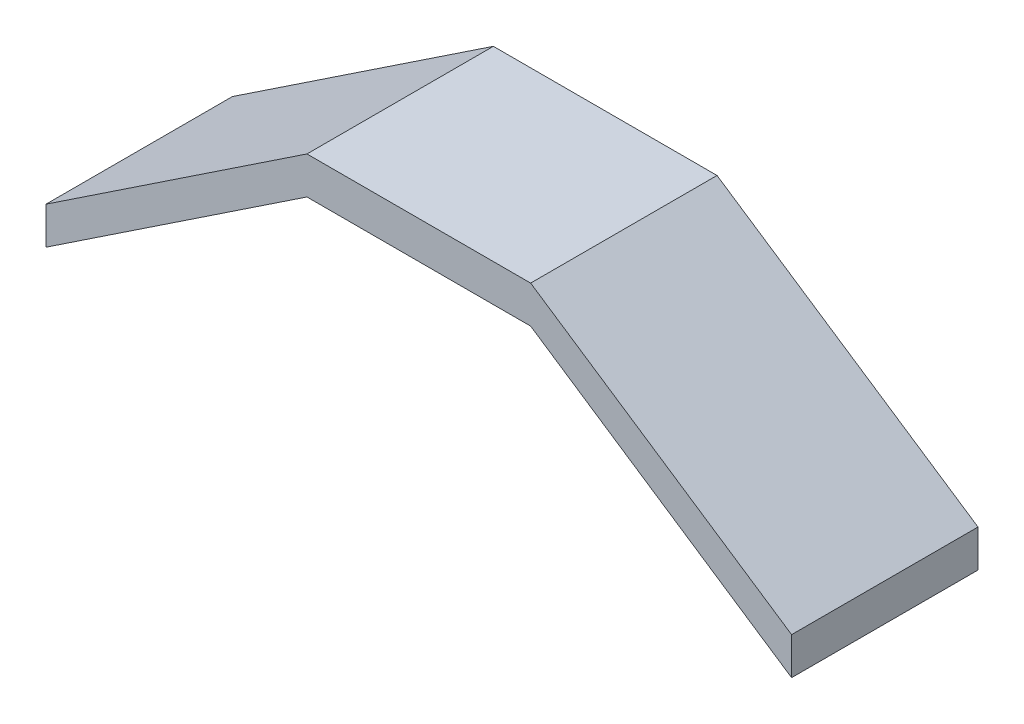
from build123d import *

# Parameters (mm, degrees)
SKETCH1_W           = 100
SKETCH1_H           = 50
BOSS_EXTRUDE1_DEPTH = 5
CUT_EXTRUDE1_DEPTH  = 57.124860802
CUT_EXTRUDE2_DEPTH  = 57.124860802
BOSS_EXTRUDE2_DEPTH = 20


with BuildPart() as part:
    # Sketch1 → Boss-Extrude1 (new body)
    with BuildSketch(Plane.XY):
        Rectangle(SKETCH1_W, SKETCH1_H)
    extrude(amount=BOSS_EXTRUDE1_DEPTH)

    # Sketch2 → Cut-Extrude1 (cut, through all)
    with BuildSketch(Plane(origin=(0, 0, 0), x_dir=(-1, 0, 0), z_dir=(0, 0, -1))):
        Polygon((-50, 1.666666667), (-15, 25), (-50, 25), align=None)
        Polygon((50, 25), (15, 25), (50, 1.666666667), align=None)
    extrude(amount=-CUT_EXTRUDE1_DEPTH, mode=Mode.SUBTRACT)

    # Sketch3 → Cut-Extrude2 (cut, through all)
    with BuildSketch(Plane.XY.offset(5)):
        Polygon((-50, -3.333333333), (-15, 20), (15, 20), (50, -3.333333333), (50, -25), (-50, -25), align=None)
    extrude(amount=-CUT_EXTRUDE2_DEPTH, mode=Mode.SUBTRACT)

    # Sketch4 → Boss-Extrude2 (add)
    with BuildSketch(Plane.XY.offset(5)):
        Polygon((-50, 1.666666667), (-50, -3.333333333), (-15, 20), (15, 20), (50, -3.333333333), (50, 1.666666667), (15, 25), (-15, 25), align=None)
    extrude(amount=BOSS_EXTRUDE2_DEPTH)


solid = part.part
